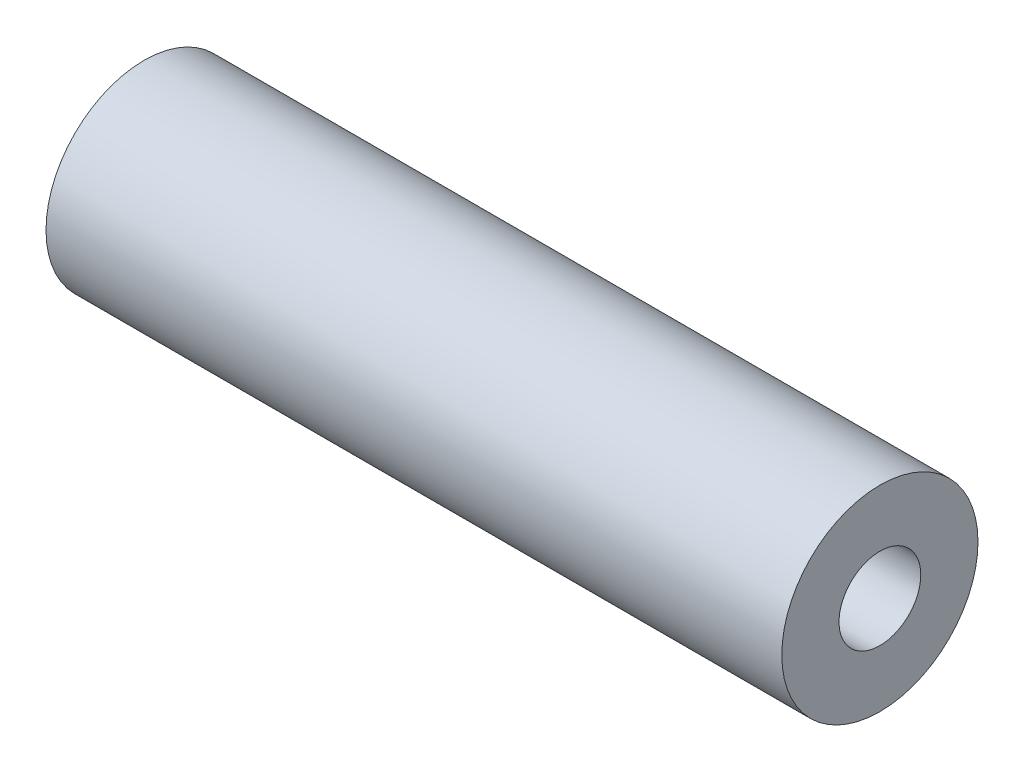
from build123d import *

# Parameters (mm, degrees)
SKETCH1_R           = 7.2
SKETCH1_R_2         = 3
BOSS_EXTRUDE1_DEPTH = 54
SCALE1_SCALE        = 1.05


with BuildPart() as part:
    # Sketch1 → Boss-Extrude1 (new body)
    with BuildSketch(Plane(origin=(0, 0, 0), x_dir=(0, 0, -1), z_dir=(1, 0, 0))):
        Circle(SKETCH1_R)
        Circle(SKETCH1_R_2, mode=Mode.SUBTRACT)
    extrude(amount=BOSS_EXTRUDE1_DEPTH)


with BuildPart() as part_1:
    # Scale1: scaled about (27, 0, 0)
    add(part.part.scale(SCALE1_SCALE).moved(Location((-1.35, 0, 0))))


solid = part_1.part
